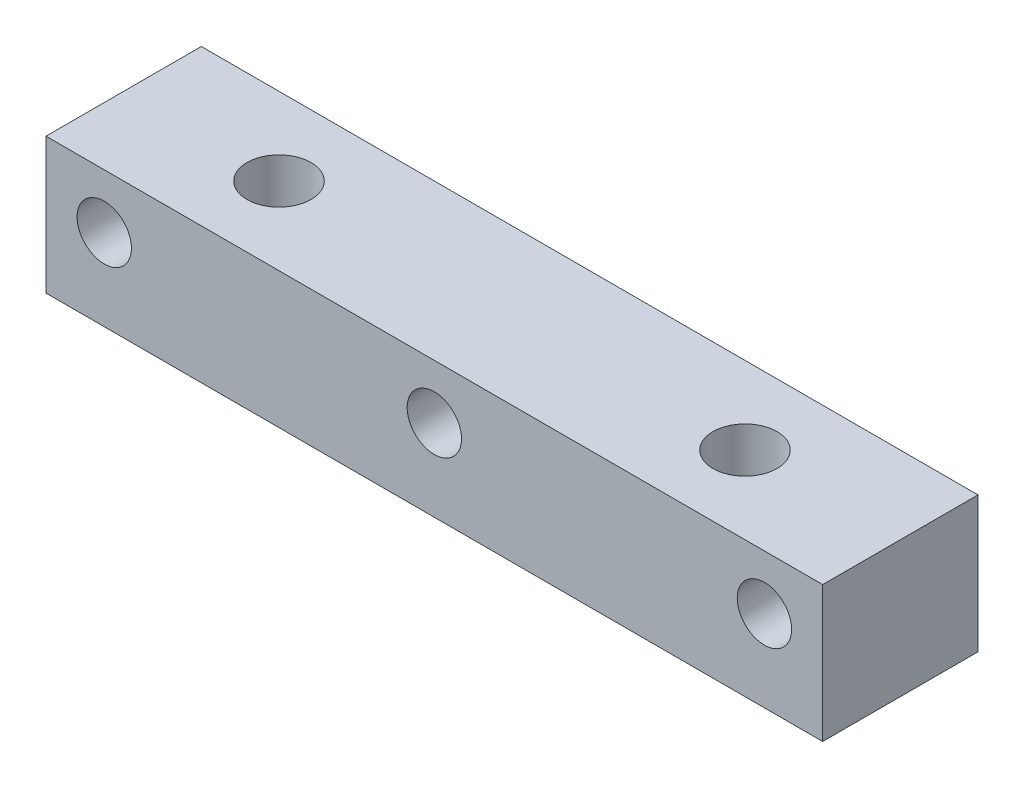
from build123d import *

# Parameters (mm, degrees)
ESQUISSE1_W             = 40
ESQUISSE1_H             = 7
BOSS_EXTRU_1_DEPTH      = 8
ESQUISSE2_R             = 1.4
ENL_V_MAT_EXTRU_1_DEPTH = 42.388404173
ESQUISSE3_R             = 1.65
ENL_V_MAT_EXTRU_2_DEPTH = 42.388404173


with BuildPart() as part:
    # Esquisse1 → Boss.-Extru.1 (new body)
    with BuildSketch(Plane.XY):
        with Locations((20, 3.5)):
            Rectangle(ESQUISSE1_W, ESQUISSE1_H)
    extrude(amount=BOSS_EXTRU_1_DEPTH)

    # Esquisse2 → Enlèv. mat.-Extru.1 (cut, through all)
    with BuildSketch(Plane.XY.offset(8)):
        with Locations((20, 4.2)):
            Circle(ESQUISSE2_R)
        with Locations((3, 4.2)):
            Circle(ESQUISSE2_R)
        with Locations(Location((37, 4.2, 0), (0, 0, 180))):
            Circle(ESQUISSE2_R)
    extrude(amount=-ENL_V_MAT_EXTRU_1_DEPTH, mode=Mode.SUBTRACT)

    # Esquisse3 → Enlèv. mat.-Extru.2 (cut, through all)
    with BuildSketch(Plane(origin=(0, 7, 0), x_dir=(1, 0, 0), z_dir=(0, 1, 0))):
        with Locations(Location((8, -4, 0), (0, 0, 270))):
            Circle(ESQUISSE3_R)
        with Locations(Location((32, -4, 0), (0, 0, 90))):
            Circle(ESQUISSE3_R)
    extrude(amount=-ENL_V_MAT_EXTRU_2_DEPTH, mode=Mode.SUBTRACT)


solid = part.part
